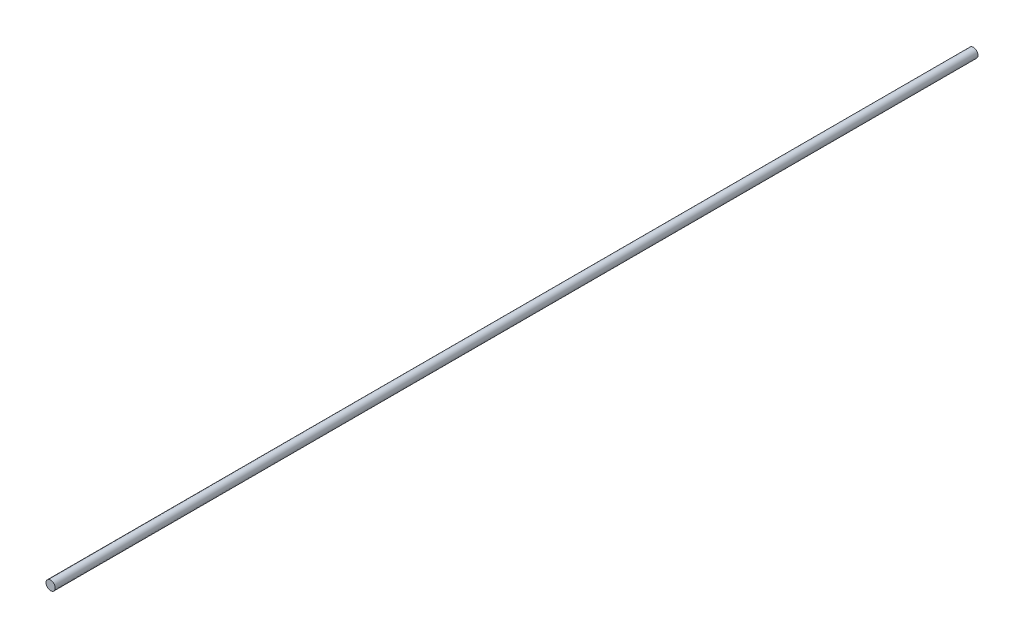
from build123d import *

# Parameters (mm, degrees)
SKETCH1_R           = 1.5
BOSS_EXTRUDE1_DEPTH = 300


with BuildPart() as part:
    # Sketch1 → Boss-Extrude1 (new body)
    with BuildSketch(Plane.XY):
        Circle(SKETCH1_R)
    extrude(amount=BOSS_EXTRUDE1_DEPTH)


solid = part.part
